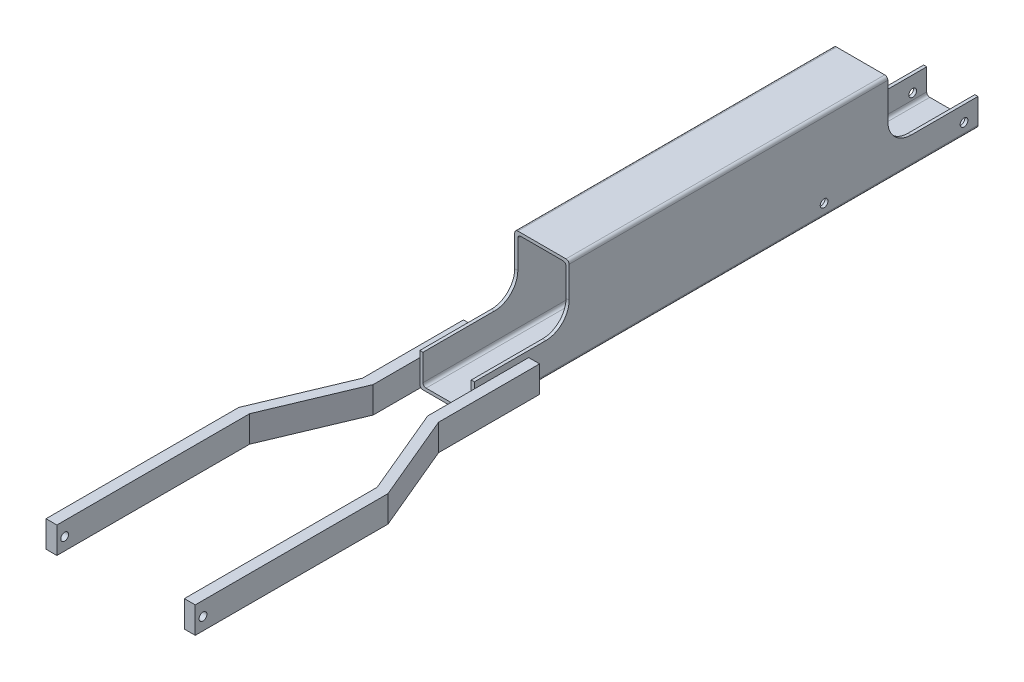
from build123d import *

# Parameters (mm, degrees)
EXTRUDE1_DEPTH = 324
SKETCH2_R      = 2.5
EXTRUDE2_DEPTH = 332.744929345
EXTRUDE3_DEPTH = 17
SKETCH4_R      = 2.5
EXTRUDE4_DEPTH = 547.100446938


with BuildPart() as part:
    # Sketch1 → Extrude1 (new body)
    with BuildSketch(Plane.XY):
        with BuildLine():
            Line((-17.939611789, -4.078161588), (13.060388211, -4.078161588))
            ThreePointArc((13.060388211, -4.078161588), (14.474601773, -4.663948025), (15.060388211, -6.078161588))
            Line((15.060388211, -6.078161588), (15.060388211, -60.078161588))
            ThreePointArc((15.060388211, -60.078161588), (14.474601773, -61.49237515), (13.060388211, -62.078161588))
            Line((13.060388211, -62.078161588), (-17.939611789, -62.078161588))
            ThreePointArc((-17.939611789, -62.078161588), (-19.353825352, -61.49237515), (-19.939611789, -60.078161588))
            Line((-19.939611789, -60.078161588), (-19.939611789, -6.078161588))
            ThreePointArc((-19.939611789, -6.078161588), (-19.353825352, -4.663948025), (-17.939611789, -4.078161588))
        make_face()
        with BuildLine():
            Line((-15.939611789, -6.078161588), (11.060388211, -6.078161588))
            ThreePointArc((11.060388211, -6.078161588), (12.474601773, -6.663948025), (13.060388211, -8.078161588))
            Line((13.060388211, -8.078161588), (13.060388211, -58.078161588))
            ThreePointArc((13.060388211, -58.078161588), (12.474601773, -59.49237515), (11.060388211, -60.078161588))
            Line((11.060388211, -60.078161588), (-15.939611789, -60.078161588))
            ThreePointArc((-15.939611789, -60.078161588), (-17.353825352, -59.49237515), (-17.939611789, -58.078161588))
            Line((-17.939611789, -58.078161588), (-17.939611789, -8.078161588))
            ThreePointArc((-17.939611789, -8.078161588), (-17.353825352, -6.663948025), (-15.939611789, -6.078161588))
        make_face(mode=Mode.SUBTRACT)
    extrude(amount=EXTRUDE1_DEPTH)

    # Sketch2 → Extrude2 (cut, through all)
    with BuildSketch(Plane(origin=(15.060388211, 0, 0), x_dir=(0, 0, -1), z_dir=(1, 0, 0))):
        with Locations(Location((-9, -54.078161588, 0), (0, 0, 90))):
            Circle(SKETCH2_R)
        with Locations(Location((-99, -54.078161588, 0), (0, 0, 90))):
            Circle(SKETCH2_R)
        with BuildLine():
            Line((0, -44.078161588), (-43, -44.078161588))
            ThreePointArc((-43, -44.078161588), (-53.606601718, -39.684763305), (-58, -29.078161588))
            Line((-58, -29.078161588), (-58, -4.078161588))
            Line((-58, -4.078161588), (0, -4.078161588))
            Line((0, -4.078161588), (0, -44.078161588))
        make_face()
        with BuildLine():
            Line((-324, -41.078161588), (-278, -41.078161588))
            ThreePointArc((-278, -41.078161588), (-267.393398282, -36.684763305), (-263, -26.078161588))
            Line((-263, -26.078161588), (-263, -4.078161588))
            Line((-263, -4.078161588), (-324, -4.078161588))
            Line((-324, -4.078161588), (-324, -41.078161588))
        make_face()
    extrude(amount=-EXTRUDE2_DEPTH, mode=Mode.SUBTRACT)

    # Sketch3 → Extrude3 (add)
    with BuildSketch(Plane.XZ.offset(62.078161588)):
        Polygon((15.060388211, 324), (15.060388211, 289), (22.060388211, 289), (22.060388211, 324), (22.060388211, 354), (45.560388211, 410), (45.560388211, 534), (38.560388211, 534), (38.560388211, 410), (15.060388211, 354), align=None)
        Polygon((-19.939611789, 324), (-19.939611789, 289), (-26.939611789, 289), (-26.939611789, 324), (-26.939611789, 354), (-50.439611789, 410), (-50.439611789, 534), (-43.439611789, 534), (-43.439611789, 410), (-19.939611789, 354), align=None)
    extrude(amount=-EXTRUDE3_DEPTH)

    # Sketch4 → Extrude4 (cut, through all)
    with BuildSketch(Plane(origin=(45.560388211, 0, 0), x_dir=(0, 0, -1), z_dir=(1, 0, 0))):
        with Locations((-529, -54.078161588)):
            Circle(SKETCH4_R)
    extrude(amount=-EXTRUDE4_DEPTH, mode=Mode.SUBTRACT)


solid = part.part
